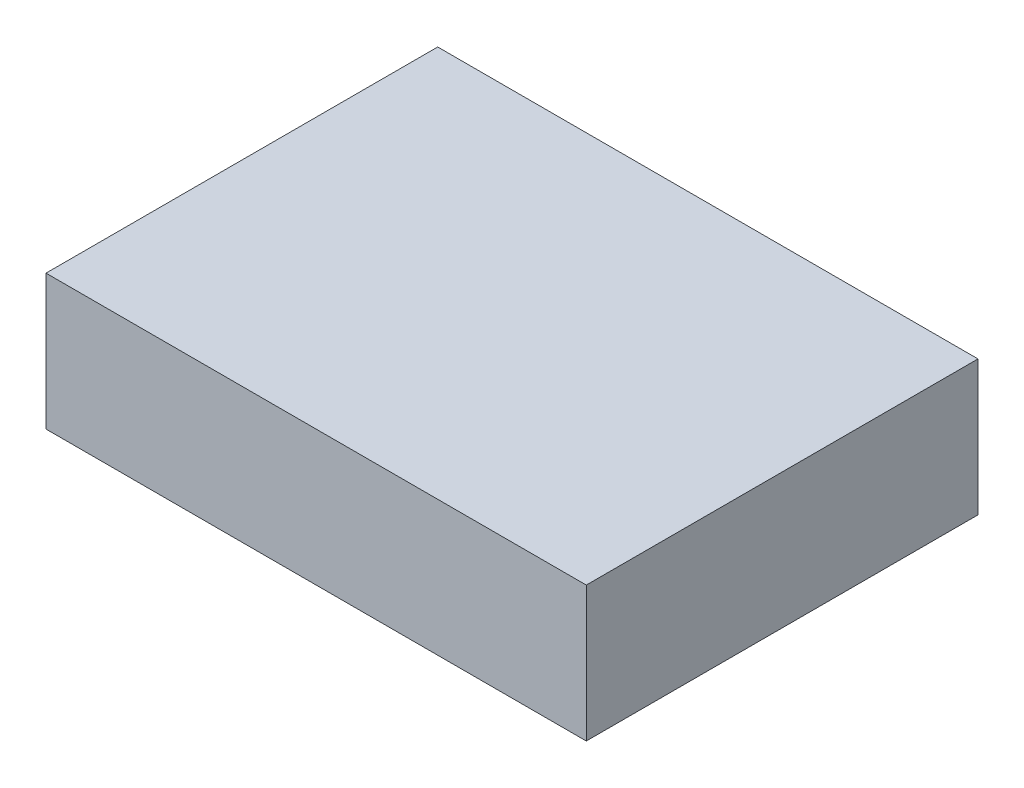
from build123d import *

# Parameters (mm, degrees)
SKETCH1_W           = 40
SKETCH1_H           = 29
BOSS_EXTRUDE1_DEPTH = 10


with BuildPart() as part:
    # Sketch1 → Boss-Extrude1 (new body)
    with BuildSketch(Plane(origin=(0, 0, 0), x_dir=(1, 0, 0), z_dir=(0, 1, 0))):
        with Locations((20, 14.5)):
            Rectangle(SKETCH1_W, SKETCH1_H)
    extrude(amount=-BOSS_EXTRUDE1_DEPTH)


solid = part.part
